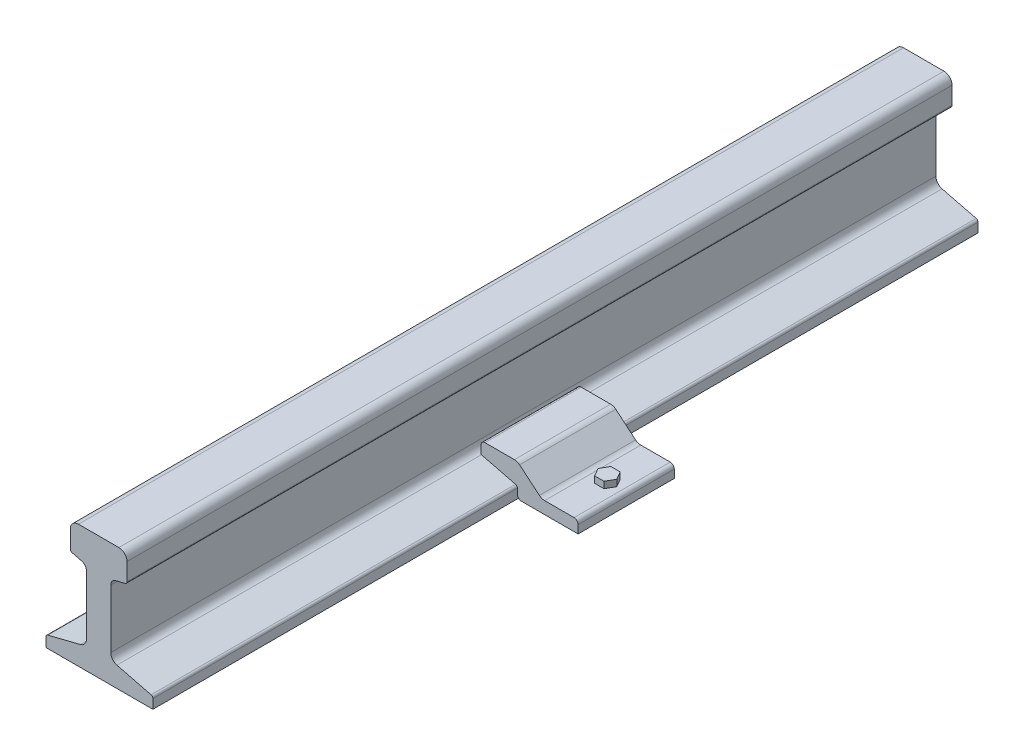
from build123d import *

# Parameters (mm, degrees)
EXTRUDE_1_DEPTH   = 1018.75
FILLET_1_R        = 10
FILLET_2_R        = 8
FILLET_3_R        = 3
FILLET_4_R        = 10
FILLET_5_R        = 3
EXTRUDE_START     = 118.75
EXTRUDE_1_2_DEPTH = 118.75
EXTRUDE_2_DEPTH   = 8


with BuildPart() as part:
    # 草图1 → Extrude 1 (new body)
    with BuildSketch(Plane.XY):
        Polygon((-35, 49.6), (-35, 83.5), (35, 83.5), (35, 49.6), (15, 44.6), (15, -41.6), (67, -54.6), (67, -68.5), (-65, -68.5), (-65, -54.6), (-15, -42.1), (-15, 44.6), align=None)
    extrude(amount=EXTRUDE_1_DEPTH)

    # 圆角1
    fillet_1_edges = [part.edges().sort_by_distance(p)[0] for p in [
        (15, -41.6, 509.375),
        (-15, -42.1, 509.375),
    ]]
    fillet(fillet_1_edges, radius=FILLET_1_R)

    # 圆角2
    fillet_2_edges = [part.edges().sort_by_distance(p)[0] for p in [
        (15, 44.6, 509.375),
        (-15, 44.6, 509.375),
    ]]
    fillet(fillet_2_edges, radius=FILLET_2_R)

    # 圆角3
    fillet_3_edges = [part.edges().sort_by_distance(p)[0] for p in [
        (-35, 49.6, 509.375),
        (35, 49.6, 509.375),
    ]]
    fillet(fillet_3_edges, radius=FILLET_3_R)

    # 圆角4
    fillet_4_edges = [part.edges().sort_by_distance(p)[0] for p in [
        (-35, 83.5, 509.375),
        (35, 83.5, 509.375),
    ]]
    fillet(fillet_4_edges, radius=FILLET_4_R)

    # 圆角5
    fillet_5_edges = [part.edges().sort_by_distance(p)[0] for p in [
        (67, -54.6, 509.375),
        (-65, -54.6, 509.375),
    ]]
    fillet(fillet_5_edges, radius=FILLET_5_R)

    # 草图4 → Extrude 1 2 (add)
    with BuildSketch(Plane.XY.offset(450).offset(EXTRUDE_START)):
        with BuildLine():
            Line((142, -68.5), (142, -58.5))
            ThreePointArc((142, -58.5), (140.535533906, -54.964466094), (137, -53.5))
            Line((137, -53.5), (100.637155323, -53.5))
            ThreePointArc((100.637155323, -53.5), (97.219067588, -52.897695262), (94.212725941, -51.163335247))
            Line((94.212725941, -51.163335247), (69.787274059, -30.686664753))
            ThreePointArc((69.787274059, -30.686664753), (66.780932412, -28.952304738), (63.362844677, -28.35))
            Line((63.362844677, -28.35), (27, -28.35))
            ThreePointArc((27, -28.35), (23.464466094, -29.814466094), (22, -33.35))
            Line((22, -33.35), (22, -43.35))
            Line((22, -43.35), (64.727606875, -54.031901719))
            ThreePointArc((64.727606875, -54.031901719), (66.364616314, -55.096092591), (67, -56.942329219))
            Line((67, -56.942329219), (67, -63.5))
            ThreePointArc((67, -63.5), (68.464466094, -67.035533906), (72, -68.5))
            Line((72, -68.5), (142, -68.5))
        make_face()
    extrude_1_2 = extrude(amount=-EXTRUDE_1_2_DEPTH)

    # 草图5 → 凸台-拉伸2 (add)
    with BuildSketch(Plane(origin=(0, -53.5, 0), x_dir=(1, 0, 0), z_dir=(0, 1, 0))):
        Polygon((124.592080354, -519.375), (130.365583045, -509.375), (124.592080354, -499.375), (113.04507497, -499.375), (107.271572278, -509.375), (113.04507497, -519.375), align=None)
    extrude_2 = extrude(amount=EXTRUDE_2_DEPTH)

    # 镜向1: Extrude 1 2, 凸台-拉伸2 across plane
    add(extrude_1_2.mirror(Plane(origin=(1, 0, 0), x_dir=(0, 0, 1), z_dir=(1, 0, 0))))
    add(extrude_2.mirror(Plane(origin=(1, 0, 0), x_dir=(0, 0, 1), z_dir=(1, 0, 0))))


solid = part.part
